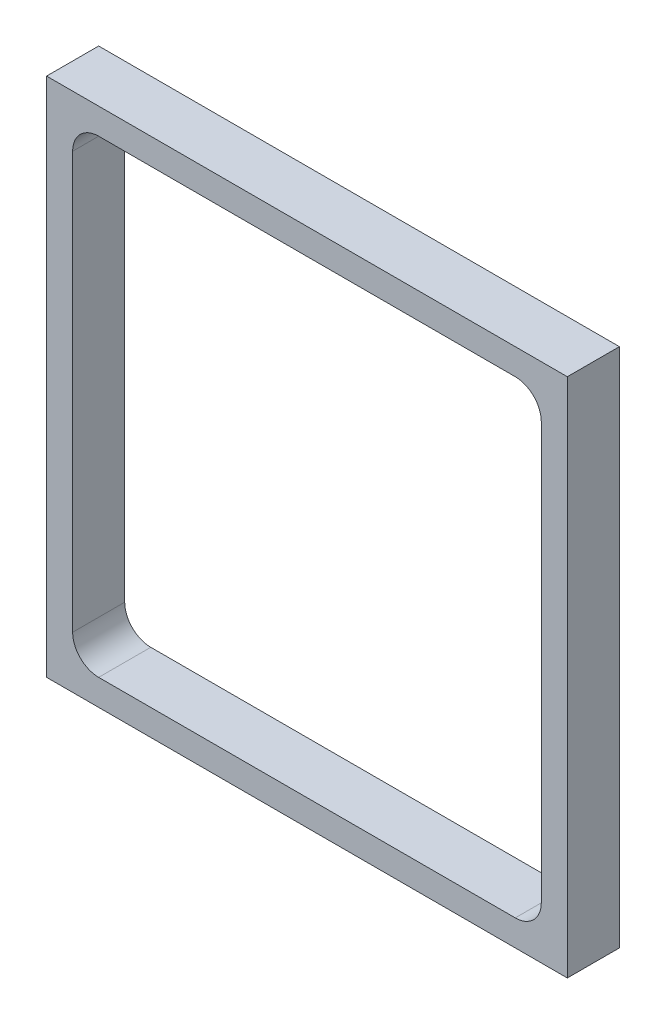
from build123d import *

# Parameters (mm, degrees)
SKETCH1_W           = 127
SKETCH1_H           = 127
SKETCH1_W_2         = 114.3
SKETCH1_H_2         = 114.3
BOSS_EXTRUDE1_DEPTH = 12.7
FILLET1_R           = 6.35


with BuildPart() as part:
    # Sketch1 → Boss-Extrude1 (new body)
    with BuildSketch(Plane.XY):
        Rectangle(SKETCH1_W, SKETCH1_H)
        Rectangle(SKETCH1_W_2, SKETCH1_H_2, mode=Mode.SUBTRACT)
    extrude(amount=-BOSS_EXTRUDE1_DEPTH)

    # Fillet1
    fillet1_edges = [part.edges().sort_by_distance(p)[0] for p in [
        (57.15, 57.15, -6.35),
        (57.15, -57.15, -6.35),
        (-57.15, -57.15, -6.35),
        (-57.15, 57.15, -6.35),
    ]]
    fillet(fillet1_edges, radius=FILLET1_R)


solid = part.part
